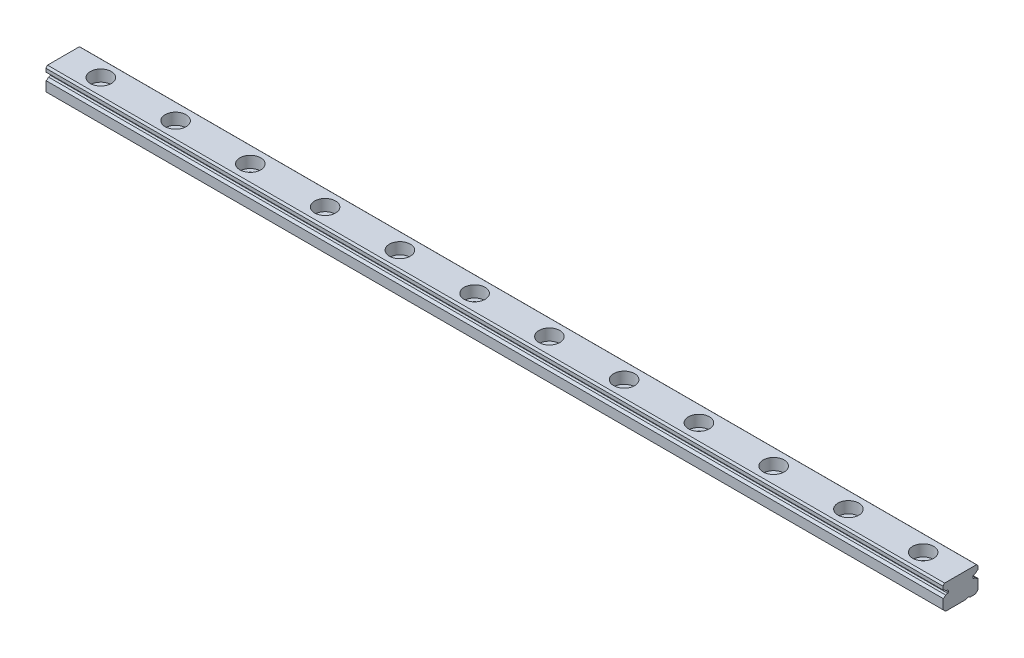
from build123d import *

# Parameters (mm, degrees)
EXTRUDE1_DEPTH  = 180
SKETCH6_R       = 0.5
EXTRUDE2_DEPTH  = 181.103442499
LPATTERN1_COUNT = 11
LPATTERN1_PITCH = 15


with BuildPart() as part:
    # Sketch1 → Extrude1 (new body)
    with BuildSketch(Plane(origin=(0, 0, 0), x_dir=(0, 0, -1), z_dir=(1, 0, 0))):
        with BuildLine():
            Line((-3.5, 0.5), (-3, 0))
            Line((-3, 0), (3, 0))
            Line((3, 0), (3.5, 0.5))
            Line((3.5, 0.5), (3.5, 2.465153077))
            ThreePointArc((3.5, 2.465153077), (3.211148341, 2.591798371), (2.999904622, 2.826))
            Line((2.999904622, 2.826), (2.572, 2.90145113))
            ThreePointArc((2.572, 2.90145113), (2.501845147, 2.968757157), (2.45, 3.051))
            Line((2.45, 3.051), (2.45, 3.349))
            ThreePointArc((2.45, 3.349), (2.501845147, 3.431242843), (2.572, 3.49854887))
            Line((2.572, 3.49854887), (2.999904622, 3.574))
            ThreePointArc((2.999904622, 3.574), (3.211148341, 3.808201629), (3.5, 3.934846923))
            Line((3.5, 3.934846923), (3.5, 4.6))
            ThreePointArc((3.5, 4.6), (3.382052634, 4.824039475), (3.2, 5))
            Line((3.2, 5), (-3.2, 5))
            ThreePointArc((-3.2, 5), (-3.382052634, 4.824039475), (-3.5, 4.6))
            Line((-3.5, 4.6), (-3.5, 3.934846923))
            ThreePointArc((-3.5, 3.934846923), (-3.211148341, 3.808201629), (-2.999904622, 3.574))
            Line((-2.999904622, 3.574), (-2.572, 3.49854887))
            ThreePointArc((-2.572, 3.49854887), (-2.501845147, 3.431242843), (-2.45, 3.349))
            Line((-2.45, 3.349), (-2.45, 3.051))
            ThreePointArc((-2.45, 3.051), (-2.501845147, 2.968757157), (-2.572, 2.90145113))
            Line((-2.572, 2.90145113), (-2.999904622, 2.826))
            ThreePointArc((-2.999904622, 2.826), (-3.211148341, 2.591798371), (-3.5, 2.465153077))
            Line((-3.5, 2.465153077), (-3.5, 0.5))
        make_face()
    extrude(amount=EXTRUDE1_DEPTH)

    # Sketch2 → Cut-Revolve1 (revolve, cut)
    with BuildSketch(Plane(origin=(0, 0, 0), x_dir=(-1, 0, 0), z_dir=(0, 0, -1))):
        Polygon((-7.5, 5), (-5.4, 5), (-5.4, 2.7), (-6.3, 2.7), (-6.3, 0.2), (-6.1, 0), (-7.5, 0), align=None)
    revolve(axis=Axis((7.5, 0, 0), (0, 1, 0)), mode=Mode.SUBTRACT)

    # Sketch3 → Cut-Revolve2 (revolve, cut)
    with BuildSketch(Plane(origin=(45, 0, 0), x_dir=(-1, 0, 0), z_dir=(0, 0, -1))):
        Polygon((-127.5, 5), (-125.4, 5), (-125.4, 2.7), (-126.3, 2.7), (-126.3, 0.2), (-126.1, 0), (-127.5, 0), align=None)
    cut_revolve2 = revolve(axis=Axis((172.5, 0, 0), (0, 1, 0)), mode=Mode.SUBTRACT)

    # Sketch6 → Extrude2 (cut, through all)
    with BuildSketch(Plane(origin=(0, 0, 0), x_dir=(0, 0, -1), z_dir=(1, 0, 0))):
        with Locations((1.5, -0.3)):
            Circle(SKETCH6_R)
    extrude(amount=EXTRUDE2_DEPTH, mode=Mode.SUBTRACT)

    # LPattern1: Cut-Revolve2 ×11
    with Locations(*[(-i * LPATTERN1_PITCH, 0, 0) for i in range(1, LPATTERN1_COUNT)]):
        add(cut_revolve2, mode=Mode.SUBTRACT)


solid = part.part
